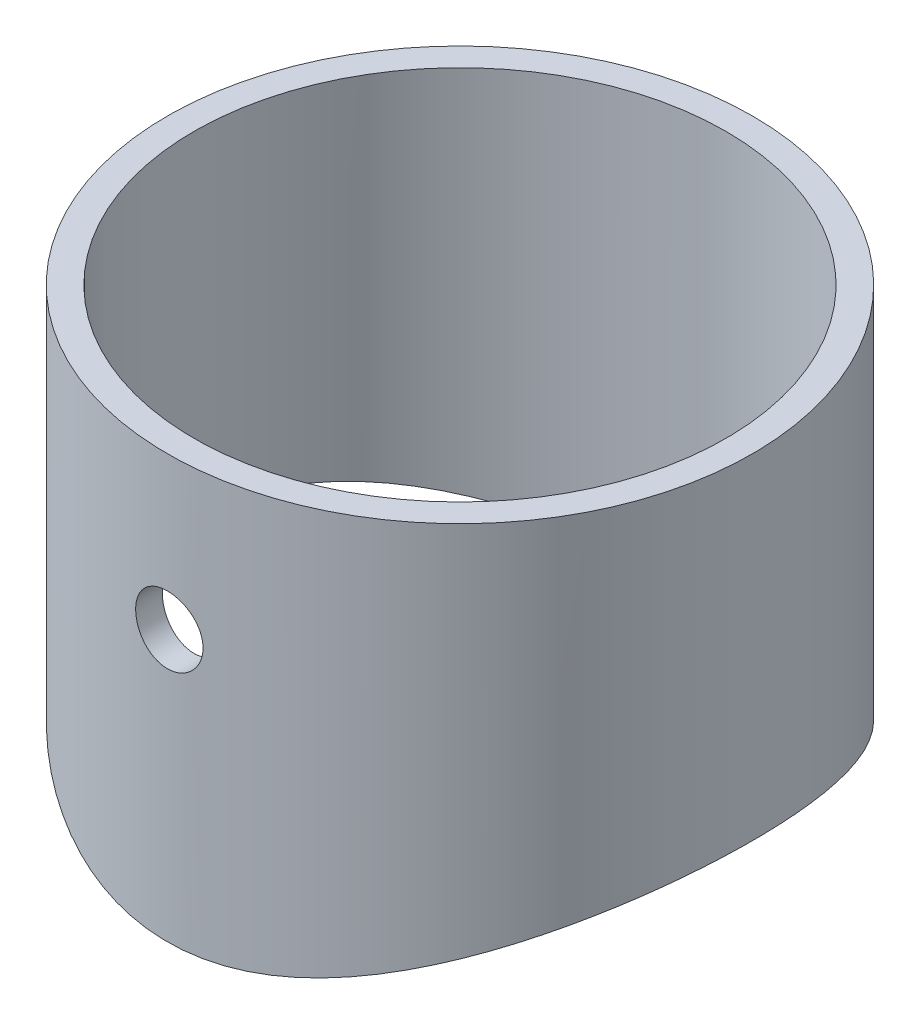
from build123d import *

# Parameters (mm, degrees)
SKETCH_1_W         = 15
SKETCH_1_H         = 239
SKETCH1_R          = 300
CUT_EXTRUDE1_DEPTH = 2660.902629797
SKETCH2_R          = 19
CUT_EXTRUDE2_DEPTH = 335.022454505


with BuildPart() as part:
    # Эскиз1 → Повернуть1 (revolve)
    with BuildSketch(Plane.XY, mode=Mode.PRIVATE) as revolve_1_sk:
        with Locations((-157.5, 119.5)):
            Rectangle(SKETCH_1_W, SKETCH_1_H)
    revolve(revolve_1_sk.sketch.rotate(Axis((0, 0, 0), (0, 1, 0)), 270), axis=Axis((0, 0, 0), (0, 1, 0)))

    # Sketch1 → Cut-Extrude1 (cut, through all)
    with BuildSketch(Plane(origin=(2479, 0, 0), x_dir=(0, 0, -1), z_dir=(1, 0, 0))):
        with Locations((0, -250)):
            Circle(SKETCH1_R)
    extrude(amount=-CUT_EXTRUDE1_DEPTH, mode=Mode.SUBTRACT)

    # Sketch2 → Cut-Extrude2 (cut, through all)
    with BuildSketch(Plane.XY):
        with Locations(Location((0, 153, 0), (0, 0, 180))):
            Circle(SKETCH2_R)
    extrude(amount=CUT_EXTRUDE2_DEPTH, mode=Mode.SUBTRACT)


solid = part.part
